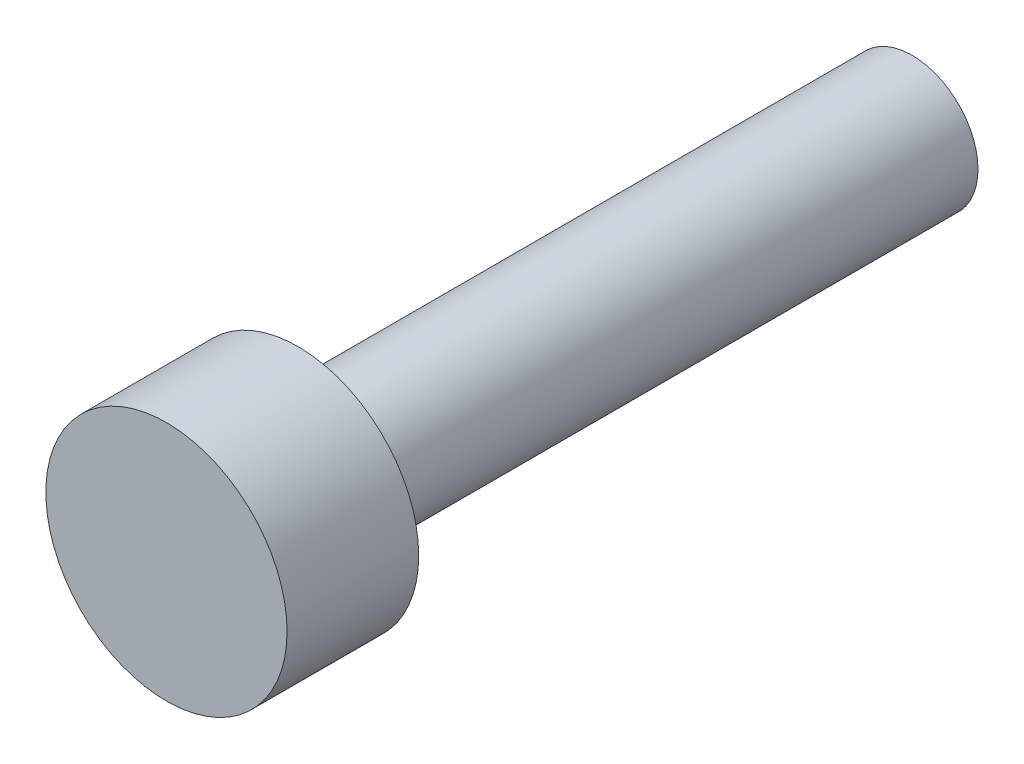
from build123d import *

# Parameters (mm, degrees)
SKETCH_1_R        = 1.5
EXTRUDE_M3_DEPTH  = 14
EXTRUDE_START     = 14
SKETCH_2_R        = 2.75
EXTRUDE_265_DEPTH = 3


with BuildPart() as part:
    # 草图1 → M3杆 (new body)
    with BuildSketch(Plane.XY):
        Circle(SKETCH_1_R)
    extrude(amount=EXTRUDE_M3_DEPTH)

    # 草图2 → Extrude 265 (add)
    with BuildSketch(Plane.XY.offset(EXTRUDE_START)):
        Circle(SKETCH_2_R)
    extrude(amount=EXTRUDE_265_DEPTH)


solid = part.part
